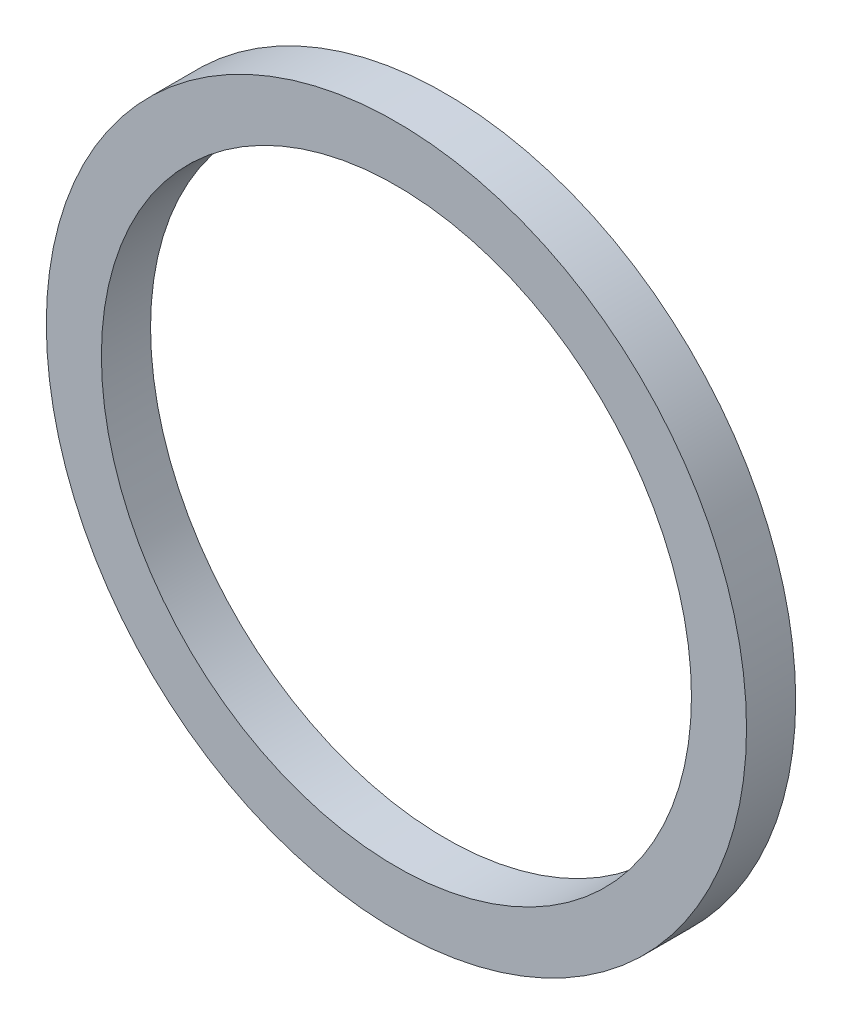
from build123d import *

# Parameters (mm, degrees)
SKETCH1_R           = 22.606
SKETCH1_R_2         = 19.05
BOSS_EXTRUDE1_DEPTH = 3.175


with BuildPart() as part:
    # Sketch1 → Boss-Extrude1 (new body)
    with BuildSketch(Plane.XY):
        Circle(SKETCH1_R)
        Circle(SKETCH1_R_2, mode=Mode.SUBTRACT)
    extrude(amount=BOSS_EXTRUDE1_DEPTH)


solid = part.part
